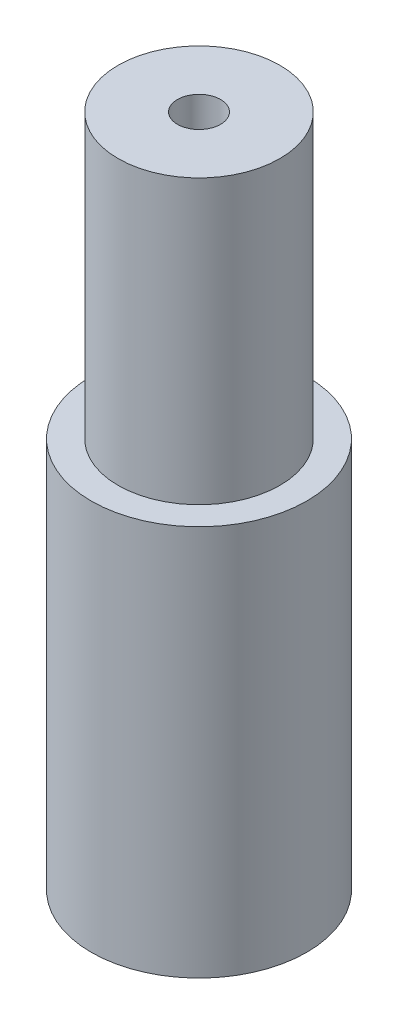
from build123d import *

# Parameters (mm, degrees)
SKETCH1_R           = 4
BOSS_EXTRUDE1_DEPTH = 14.5
SKETCH2_R           = 3
BOSS_EXTRUDE2_DEPTH = 10.5
SKETCH3_R           = 0.8
CUT_EXTRUDE1_DEPTH  = 25


with BuildPart() as part:
    # Sketch1 → Boss-Extrude1 (new body)
    with BuildSketch(Plane(origin=(0, 0, 0), x_dir=(1, 0, 0), z_dir=(0, 1, 0))):
        Circle(SKETCH1_R)
    extrude(amount=BOSS_EXTRUDE1_DEPTH)

    # Sketch2 → Boss-Extrude2 (add)
    with BuildSketch(Plane(origin=(0, 14.5, 0), x_dir=(1, 0, 0), z_dir=(0, 1, 0))):
        Circle(SKETCH2_R)
    extrude(amount=BOSS_EXTRUDE2_DEPTH)

    # Sketch3 → Cut-Extrude1 (cut)
    with BuildSketch(Plane(origin=(0, 25, 0), x_dir=(1, 0, 0), z_dir=(0, 1, 0))):
        Circle(SKETCH3_R)
    extrude(amount=-CUT_EXTRUDE1_DEPTH, mode=Mode.SUBTRACT)


solid = part.part
